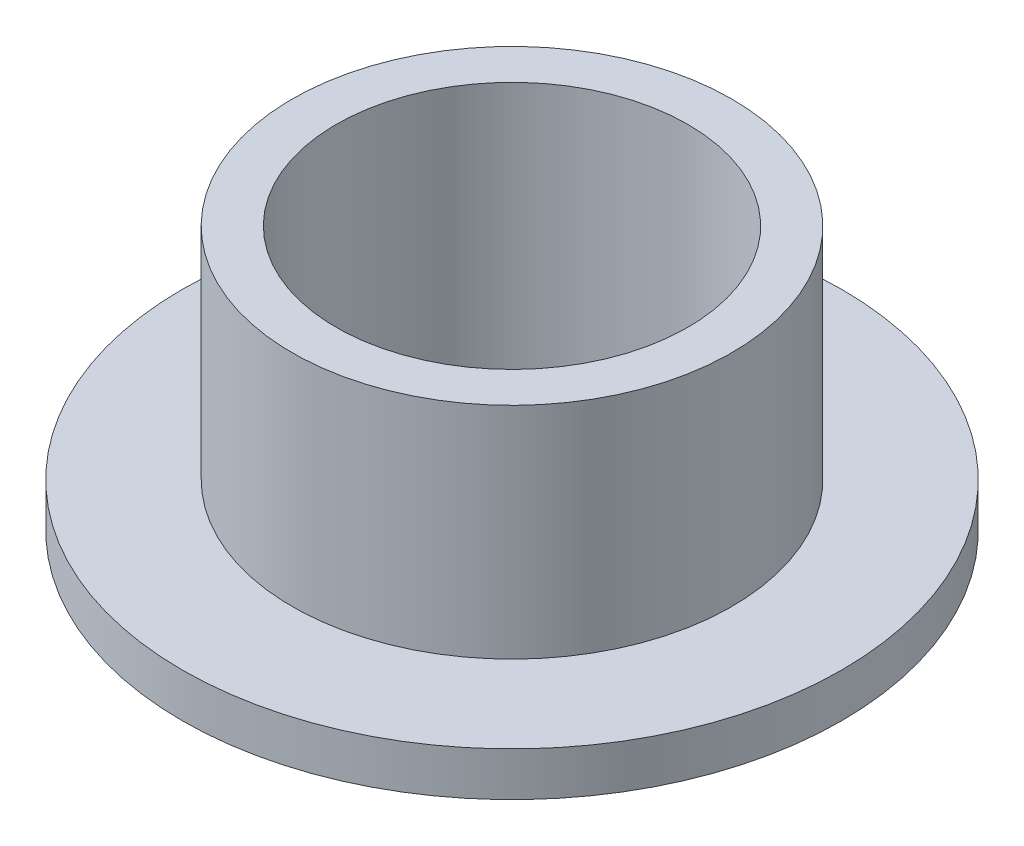
from build123d import *


with BuildPart() as part:
    # Croquis1 → Revolución1 (revolve)
    with BuildSketch(Plane.XY, mode=Mode.PRIVATE) as revoluci_n1_sk:
        Polygon((-4, 6), (-4, 0), (-7.5, 0), (-7.5, 1), (-5, 1), (-5, 6), align=None)
    revolve(revoluci_n1_sk.sketch.rotate(Axis((0, 0, 0), (0, 1, 0)), 270), axis=Axis((0, 0, 0), (0, 1, 0)))


solid = part.part
